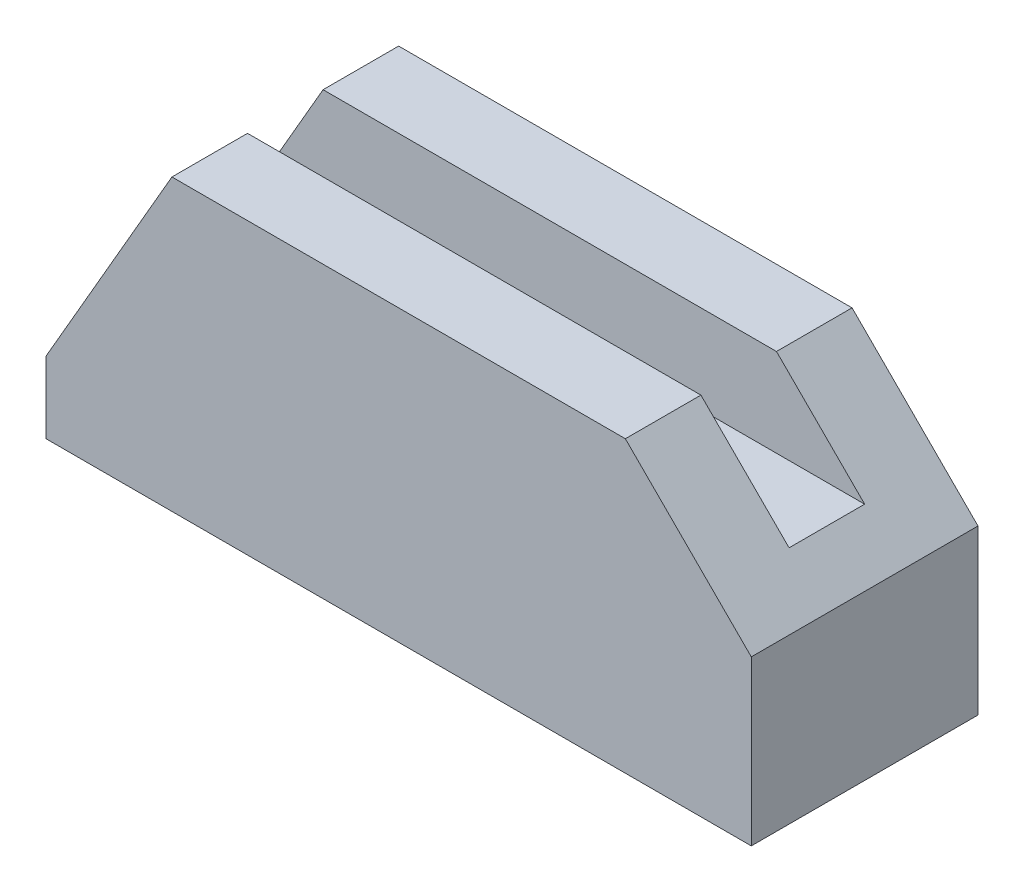
from build123d import *

# Parameters (mm, degrees)
BOSS_EXTRUDE1_DEPTH = 9
SKETCH2_W           = 206.758876678
SKETCH2_H           = 6
CUT_EXTRUDE1_DEPTH  = 7


with BuildPart() as part:
    # Sketch1 → Boss-Extrude1 (new, symmetric)
    with BuildSketch(Plane.XY):
        Polygon((-28, 0), (28, 0), (28, 13), (18, 23), (-18, 23), (-28, 5.679491924), align=None)
    extrude(amount=BOSS_EXTRUDE1_DEPTH, both=True)

    # Sketch2 → Cut-Extrude1 (cut)
    with BuildSketch(Plane(origin=(0, 23, 0), x_dir=(1, 0, 0), z_dir=(0, 1, 0))):
        Rectangle(SKETCH2_W, SKETCH2_H)
    extrude(amount=-CUT_EXTRUDE1_DEPTH, mode=Mode.SUBTRACT)


solid = part.part
